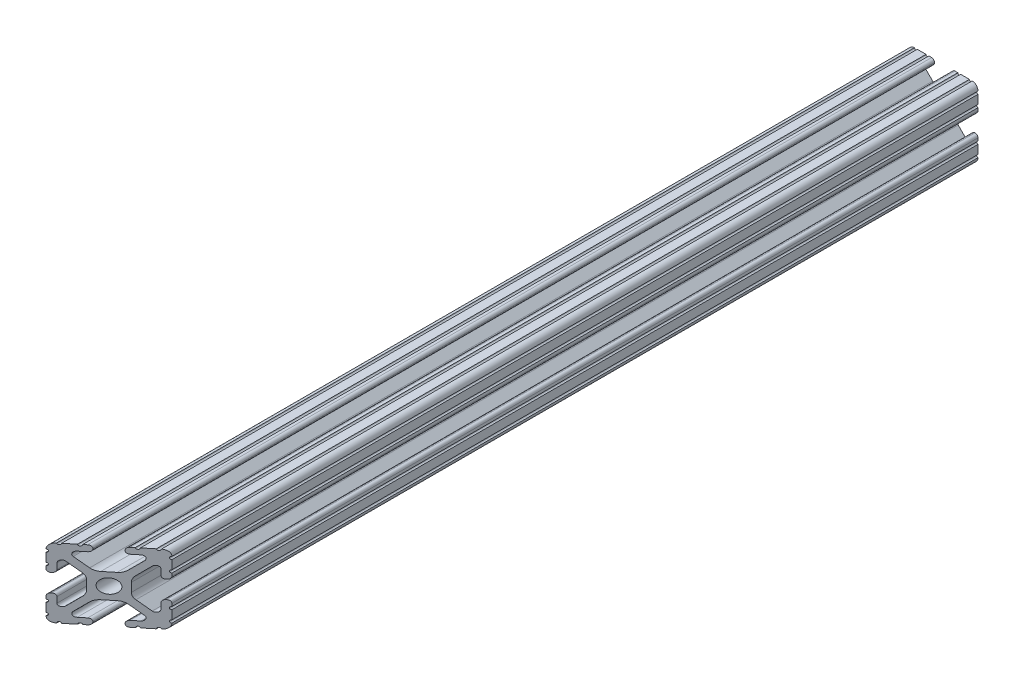
from build123d import *

# Parameters (mm, degrees)
SKETCH1_R           = 2.6035
BOSS_EXTRUDE1_DEPTH = 190.5
CUT_EXTRUDE1_DEPTH  = 193.605036279


with BuildPart() as part:
    # Sketch1 → Boss-Extrude1 (new, symmetric)
    with BuildSketch(Plane.XY):
        with BuildLine():
            Line((-7.179650497, -8.645192506), (-3.952270251, -5.423690499))
            ThreePointArc((-3.952270251, -5.423690499), (-2.922936451, -4.736929036), (-1.709253557, -4.4958))
            Line((-1.709253557, -4.4958), (1.709253557, -4.4958))
            ThreePointArc((1.709253557, -4.4958), (2.922936451, -4.736929036), (3.952270251, -5.423690499))
            Line((3.952270251, -5.423690499), (7.179650497, -8.645192506))
            ThreePointArc((7.179650497, -8.645192506), (7.41473083, -9.822813117), (6.416408329, -10.4902))
            Line((6.416408329, -10.4902), (4.287512407, -10.4902))
            ThreePointArc((4.287512407, -10.4902), (3.54574862, -10.79744862), (3.2385, -11.539212407))
            Line((3.2385, -11.539212407), (3.2385, -11.650987593))
            ThreePointArc((3.2385, -11.650987593), (3.54574862, -12.39275138), (4.287512407, -12.7))
            Line((4.287512407, -12.7), (5.317126718, -12.7))
            ThreePointArc((5.317126718, -12.7), (5.825126718, -12.192), (6.333126718, -12.7))
            Line((6.333126718, -12.7), (9.550443118, -12.7))
            ThreePointArc((9.550443118, -12.7), (10.058366869, -12.192000006), (10.566443095, -12.699847501))
            ThreePointArc((10.566443095, -12.699847501), (12.082537762, -12.08250727), (12.699846982, -10.566399977))
            ThreePointArc((12.699846982, -10.566399977), (12.192000006, -10.058323491), (12.7, -9.5504))
            Line((12.7, -9.5504), (12.7, -6.3330836))
            ThreePointArc((12.7, -6.3330836), (12.192, -5.8250836), (12.7, -5.3170836))
            Line((12.7, -5.3170836), (12.7, -4.287469289))
            ThreePointArc((12.7, -4.287469289), (12.39275138, -3.545705502), (11.650987593, -3.238456882))
            Line((11.650987593, -3.238456882), (11.539212407, -3.238456882))
            ThreePointArc((11.539212407, -3.238456882), (10.79744862, -3.545705502), (10.4902, -4.287469289))
            Line((10.4902, -4.287469289), (10.4902, -6.402089023))
            ThreePointArc((10.4902, -6.402089023), (9.856505071, -7.351067942), (8.737131347, -7.129408934))
            Line((8.737131347, -7.129408934), (5.441005833, -3.840816462))
            ThreePointArc((5.441005833, -3.840816462), (4.750877967, -2.809883091), (4.5085, -1.593185507))
            Line((4.5085, -1.593185507), (4.5085, 1.593185507))
            ThreePointArc((4.5085, 1.593185507), (4.750877967, 2.809883091), (5.441005833, 3.840816462))
            Line((5.441005833, 3.840816462), (8.737131347, 7.129408934))
            ThreePointArc((8.737131347, 7.129408934), (9.856505071, 7.351067942), (10.4902, 6.402089023))
            Line((10.4902, 6.402089023), (10.4902, 4.287469289))
            ThreePointArc((10.4902, 4.287469289), (10.79744862, 3.545705502), (11.539212407, 3.238456882))
            Line((11.539212407, 3.238456882), (11.650987593, 3.238456882))
            ThreePointArc((11.650987593, 3.238456882), (12.39275138, 3.545705502), (12.7, 4.287469289))
            Line((12.7, 4.287469289), (12.7, 5.3170836))
            ThreePointArc((12.7, 5.3170836), (12.192, 5.8250836), (12.7, 6.3330836))
            Line((12.7, 6.3330836), (12.7, 9.5504))
            ThreePointArc((12.7, 9.5504), (12.192000006, 10.058323491), (12.699846982, 10.566399977))
            ThreePointArc((12.699846982, 10.566399977), (12.082537762, 12.08250727), (10.566443095, 12.699847501))
            ThreePointArc((10.566443095, 12.699847501), (10.058366869, 12.192000006), (9.550443118, 12.7))
            Line((9.550443118, 12.7), (6.333126718, 12.7))
            ThreePointArc((6.333126718, 12.7), (5.825126718, 12.192), (5.317126718, 12.7))
            Line((5.317126718, 12.7), (4.287512407, 12.7))
            ThreePointArc((4.287512407, 12.7), (3.54574862, 12.39275138), (3.2385, 11.650987593))
            Line((3.2385, 11.650987593), (3.2385, 11.539212407))
            ThreePointArc((3.2385, 11.539212407), (3.54574862, 10.79744862), (4.287512407, 10.4902))
            Line((4.287512407, 10.4902), (6.476788598, 10.4902))
            ThreePointArc((6.476788598, 10.4902), (7.432222385, 9.85140422), (7.207036008, 8.724370562))
            Line((7.207036008, 8.724370562), (3.898272566, 5.423169045))
            ThreePointArc((3.898272566, 5.423169045), (2.869120213, 4.736787962), (1.655778399, 4.4958))
            Line((1.655778399, 4.4958), (-1.655778399, 4.4958))
            ThreePointArc((-1.655778399, 4.4958), (-2.869120213, 4.736787962), (-3.898272566, 5.423169045))
            Line((-3.898272566, 5.423169045), (-7.207036008, 8.724370562))
            ThreePointArc((-7.207036008, 8.724370562), (-7.432222385, 9.85140422), (-6.476788598, 10.4902))
            Line((-6.476788598, 10.4902), (-4.287512407, 10.4902))
            ThreePointArc((-4.287512407, 10.4902), (-3.54574862, 10.79744862), (-3.2385, 11.539212407))
            Line((-3.2385, 11.539212407), (-3.2385, 11.650987593))
            ThreePointArc((-3.2385, 11.650987593), (-3.54574862, 12.39275138), (-4.287512407, 12.7))
            Line((-4.287512407, 12.7), (-5.317126718, 12.7))
            ThreePointArc((-5.317126718, 12.7), (-5.825126718, 12.192), (-6.333126718, 12.7))
            Line((-6.333126718, 12.7), (-9.550443118, 12.7))
            ThreePointArc((-9.550443118, 12.7), (-10.058366869, 12.192000006), (-10.566443095, 12.699847501))
            ThreePointArc((-10.566443095, 12.699847501), (-12.082537762, 12.08250727), (-12.699846982, 10.566399977))
            ThreePointArc((-12.699846982, 10.566399977), (-12.192000006, 10.058323491), (-12.7, 9.5504))
            Line((-12.7, 9.5504), (-12.7, 6.3330836))
            ThreePointArc((-12.7, 6.3330836), (-12.192, 5.8250836), (-12.7, 5.3170836))
            Line((-12.7, 5.3170836), (-12.7, 4.287469289))
            ThreePointArc((-12.7, 4.287469289), (-12.39275138, 3.545705502), (-11.650987593, 3.238456882))
            Line((-11.650987593, 3.238456882), (-11.539212407, 3.238456882))
            ThreePointArc((-11.539212407, 3.238456882), (-10.79744862, 3.545705502), (-10.4902, 4.287469289))
            Line((-10.4902, 4.287469289), (-10.4902, 6.402089023))
            ThreePointArc((-10.4902, 6.402089023), (-9.856505071, 7.351067942), (-8.737131347, 7.129408934))
            Line((-8.737131347, 7.129408934), (-5.441005833, 3.840816462))
            ThreePointArc((-5.441005833, 3.840816462), (-4.750877967, 2.809883091), (-4.5085, 1.593185507))
            Line((-4.5085, 1.593185507), (-4.5085, -1.593185507))
            ThreePointArc((-4.5085, -1.593185507), (-4.750877967, -2.809883091), (-5.441005833, -3.840816462))
            Line((-5.441005833, -3.840816462), (-8.737131347, -7.129408934))
            ThreePointArc((-8.737131347, -7.129408934), (-9.856505071, -7.351067942), (-10.4902, -6.402089023))
            Line((-10.4902, -6.402089023), (-10.4902, -4.287469289))
            ThreePointArc((-10.4902, -4.287469289), (-10.79744862, -3.545705502), (-11.539212407, -3.238456882))
            Line((-11.539212407, -3.238456882), (-11.650987593, -3.238456882))
            ThreePointArc((-11.650987593, -3.238456882), (-12.39275138, -3.545705502), (-12.7, -4.287469289))
            Line((-12.7, -4.287469289), (-12.7, -5.3170836))
            ThreePointArc((-12.7, -5.3170836), (-12.192, -5.8250836), (-12.7, -6.3330836))
            Line((-12.7, -6.3330836), (-12.7, -9.5504))
            ThreePointArc((-12.7, -9.5504), (-12.192000006, -10.058323491), (-12.699846982, -10.566399977))
            ThreePointArc((-12.699846982, -10.566399977), (-12.082537762, -12.08250727), (-10.566443095, -12.699847501))
            ThreePointArc((-10.566443095, -12.699847501), (-10.058366869, -12.192000006), (-9.550443118, -12.7))
            Line((-9.550443118, -12.7), (-6.333126718, -12.7))
            ThreePointArc((-6.333126718, -12.7), (-5.825126718, -12.192), (-5.317126718, -12.7))
            Line((-5.317126718, -12.7), (-4.287512407, -12.7))
            ThreePointArc((-4.287512407, -12.7), (-3.54574862, -12.39275138), (-3.2385, -11.650987593))
            Line((-3.2385, -11.650987593), (-3.2385, -11.539212407))
            ThreePointArc((-3.2385, -11.539212407), (-3.54574862, -10.79744862), (-4.287512407, -10.4902))
            Line((-4.287512407, -10.4902), (-6.416408329, -10.4902))
            ThreePointArc((-6.416408329, -10.4902), (-7.41473083, -9.822813117), (-7.179650497, -8.645192506))
        make_face()
        Circle(SKETCH1_R, mode=Mode.SUBTRACT)
    extrude(amount=BOSS_EXTRUDE1_DEPTH, both=True)

    # Sketch2 → Cut-Extrude1 (cut, through all)
    with BuildSketch(Plane(origin=(0, 12.7, 0), x_dir=(1, 0, 0), z_dir=(0, 1, 0))):
        Polygon((12.7, -190.5), (-12.7, -190.5), (-12.7, -125.571593893), (12.7, -104.831193661), align=None)
    extrude(amount=-CUT_EXTRUDE1_DEPTH, mode=Mode.SUBTRACT)


solid = part.part
